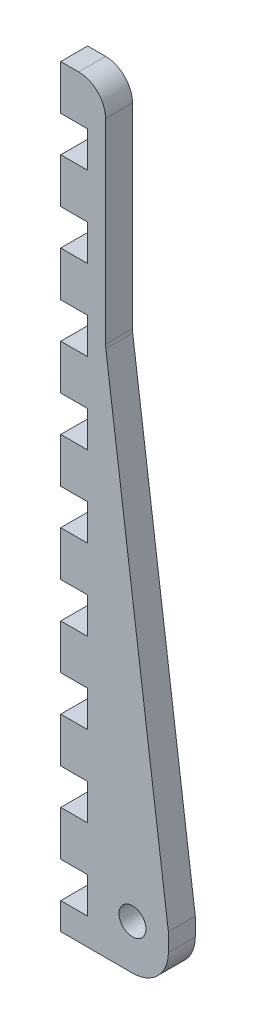
from build123d import *

# Parameters (mm, degrees)
SKETCH1_R           = 1.5
BOSS_EXTRUDE1_DEPTH = 3


with BuildPart() as part:
    # Sketch1 → Boss-Extrude1 (new body)
    with BuildSketch(Plane.XY):
        with BuildLine():
            Line((0, 7), (0, 12))
            Line((0, 12), (3, 12))
            Line((3, 12), (3, 16))
            Line((3, 16), (0, 16))
            Line((0, 16), (0, 21))
            Line((0, 21), (3, 21))
            Line((3, 21), (3, 25))
            Line((3, 25), (0, 25))
            Line((0, 25), (0, 30))
            Line((0, 30), (3, 30))
            Line((3, 30), (3, 34))
            Line((3, 34), (0, 34))
            Line((0, 34), (0, 39))
            Line((0, 39), (3, 39))
            Line((3, 39), (3, 43))
            Line((3, 43), (0, 43))
            Line((0, 43), (0, 48))
            Line((0, 48), (3, 48))
            Line((3, 48), (3, 52))
            Line((3, 52), (0, 52))
            Line((0, 52), (0, 57))
            Line((0, 57), (3, 57))
            Line((3, 57), (3, 61))
            Line((3, 61), (0, 61))
            Line((0, 61), (0, 66))
            Line((0, 66), (3, 66))
            Line((3, 66), (3, 70))
            Line((3, 70), (0, 70))
            Line((0, 70), (0, 75))
            Line((0, 75), (3, 75))
            Line((3, 75), (3, 79))
            Line((3, 79), (0, 79))
            Line((0, 79), (0, 84))
            Line((0, 84), (2, 84))
            ThreePointArc((2, 84), (4.121320344, 83.121320344), (5, 81))
            Line((5, 81), (5, 59.197256694))
            ThreePointArc((5, 59.197256694), (5.006464082, 59.000425028), (5.02582847, 58.804441586))
            Line((5.02582847, 58.804441586), (12, 6))
            Line((12, 6), (12, 4))
            ThreePointArc((12, 4), (10.828427125, 1.171572875), (8, 0))
            Line((8, 0), (0, 0))
            Line((0, 0), (0, 3))
            Line((0, 3), (3, 3))
            Line((3, 3), (3, 7))
            Line((3, 7), (0, 7))
        make_face()
        with Locations((8, 5)):
            Circle(SKETCH1_R, mode=Mode.SUBTRACT)
    extrude(amount=BOSS_EXTRUDE1_DEPTH)


solid = part.part
